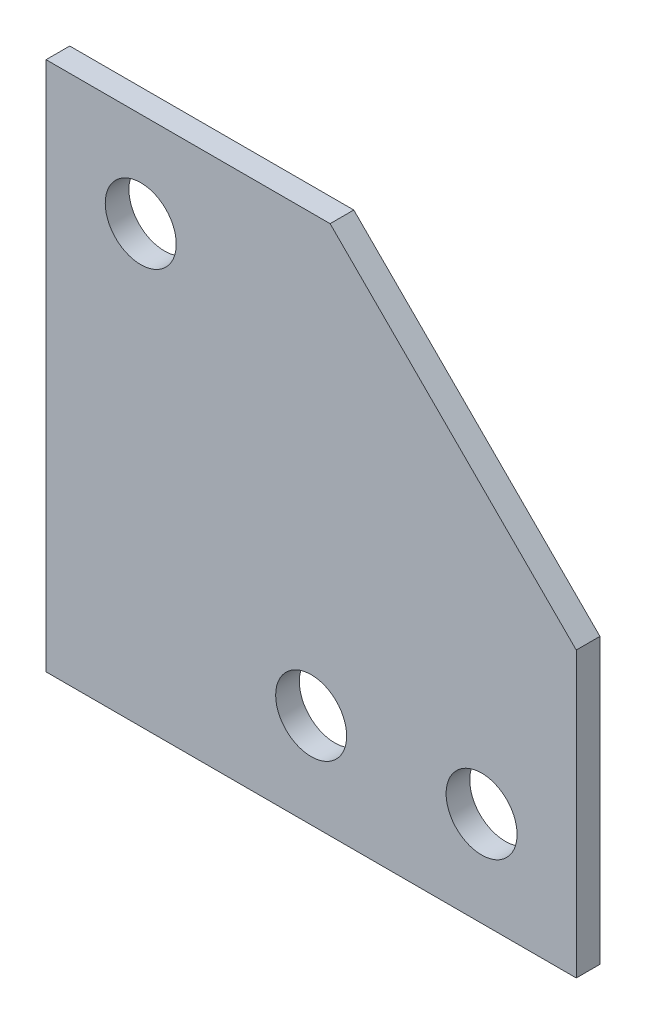
from build123d import *

# Parameters (mm, degrees)
BOSS_EXTRUDE1_DEPTH            = 1.5875
F_3_16_0_1875_DIAMETER_HOLE1_D = 4.7625


with BuildPart() as part:
    # Sketch1 → Boss-Extrude1 (new body)
    with BuildSketch(Plane.XY):
        Polygon((19.05, 0), (35.56, -16.51), (35.56, -35.56), (0, -35.56), (0, 0), align=None)
    extrude(amount=BOSS_EXTRUDE1_DEPTH)

    # 3/16 (0.1875) Diameter Hole1 (through all)
    with Locations(Plane(origin=(0, 0, 0), x_dir=(-1, 0, 0), z_dir=(0, 0, -1))):
        with Locations((-6.35, -6.35), (-17.78, -29.21), (-29.21, -29.21)):
            Hole(F_3_16_0_1875_DIAMETER_HOLE1_D / 2)


solid = part.part
